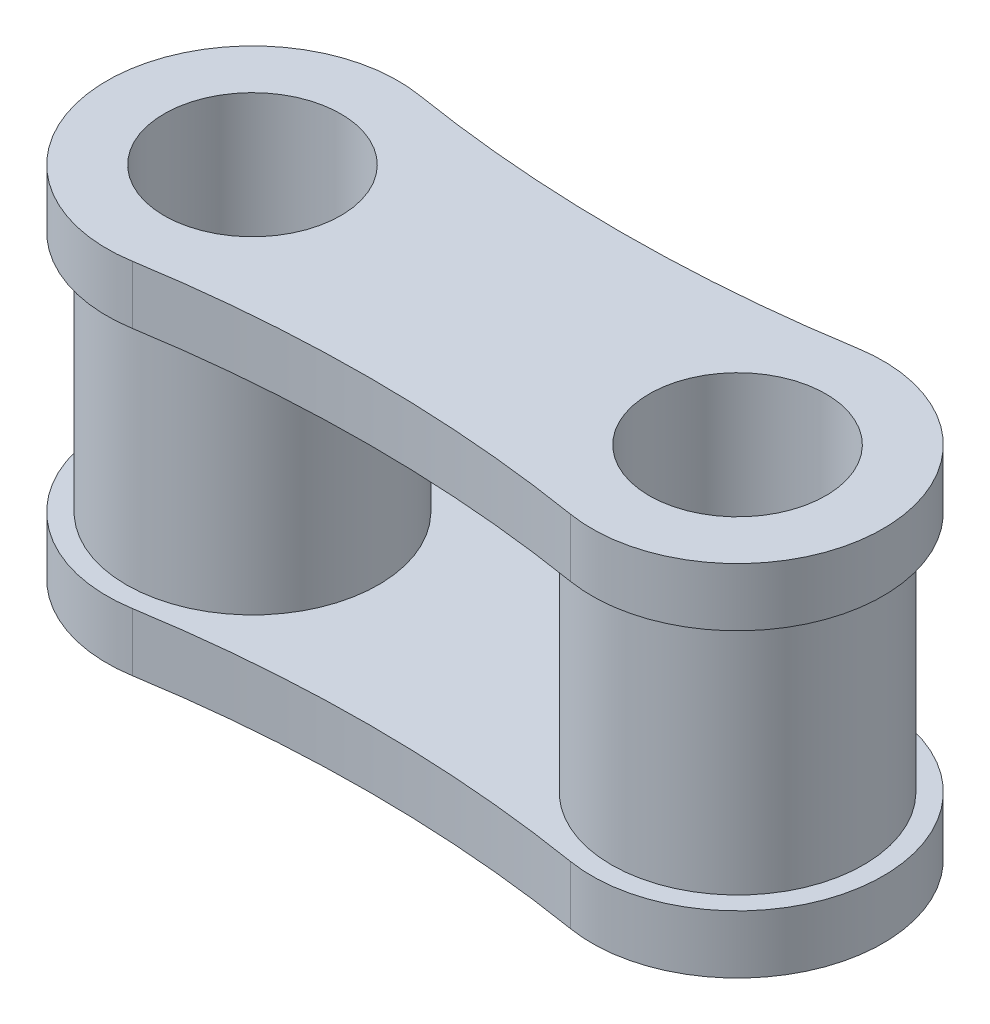
from build123d import *

# Parameters (mm, degrees)
BOSS_EXTRUDE1_DEPTH     = 0.762
SKETCH3_R               = 1.651
SKETCH3_R_2             = 1.1557
BOSS_EXTRUDE2_DEPTH     = 3.175
BOSS_EXTRUDE3_DEPTH     = 0.762
CUT_EXTRUDE1_DEPTH      = 7.703386756
CUT_EXTRUDE1_DEPTH_BACK = 7.703386756
SKETCH5_R               = 1.1557


with BuildPart() as part:
    # Sketch2 → Boss-Extrude1 (new body)
    with BuildSketch(Plane(origin=(0, 0, 0), x_dir=(1, 0, 0), z_dir=(0, 1, 0))):
        with BuildLine():
            ThreePointArc((2.867741935, -1.88005784), (5.08, 0), (2.867741935, 1.88005784))
            ThreePointArc((2.867741935, 1.88005784), (0, 1.647264347), (-2.867741935, 1.88005784))
            ThreePointArc((-2.867741935, 1.88005784), (-5.08, 0), (-2.867741935, -1.88005784))
            ThreePointArc((-2.867741935, -1.88005784), (0, -1.647264347), (2.867741935, -1.88005784))
        make_face()
    extrude(amount=BOSS_EXTRUDE1_DEPTH)

    # Sketch3 → Boss-Extrude2 (add)
    # profile 1 of 2: a face of its own
    with BuildSketch(Plane(origin=(0, 0.762, 0), x_dir=(1, 0, 0), z_dir=(0, 1, 0))):
        with Locations(Location((-3.175, 0, 0), (0, 0, 270))):
            Circle(SKETCH3_R)
        with Locations(Location((-3.175, 0, 0), (0, 0, 270))):
            Circle(SKETCH3_R_2, mode=Mode.SUBTRACT)
    # profile 2 of 2: a face of its own
    with BuildSketch(Plane(origin=(0, 0.762, 0), x_dir=(1, 0, 0), z_dir=(0, 1, 0))):
        with Locations(Location((3.175, 0, 0), (0, 0, 270))):
            Circle(SKETCH3_R)
        with Locations(Location((3.175, 0, 0), (0, 0, 270))):
            Circle(SKETCH3_R_2, mode=Mode.SUBTRACT)
    extrude(amount=BOSS_EXTRUDE2_DEPTH)

    # Sketch4 → Boss-Extrude3 (add)
    with BuildSketch(Plane(origin=(0, 3.937, 0), x_dir=(1, 0, 0), z_dir=(0, 1, 0))):
        with BuildLine():
            ThreePointArc((2.867741935, -1.88005784), (0, -1.647264347), (-2.867741935, -1.88005784))
            ThreePointArc((-2.867741935, -1.88005784), (-5.08, 0), (-2.867741935, 1.88005784))
            ThreePointArc((-2.867741935, 1.88005784), (0, 1.647264347), (2.867741935, 1.88005784))
            ThreePointArc((2.867741935, 1.88005784), (5.08, 0), (2.867741935, -1.88005784))
        make_face()
    extrude(amount=BOSS_EXTRUDE3_DEPTH)

    # Sketch5 → Cut-Extrude1 (cut, two sides: drawn at the far end of the back side and taken through both)
    with BuildSketch(Plane(origin=(0, 0.762, 0), x_dir=(1, 0, 0), z_dir=(0, 1, 0)).offset(-CUT_EXTRUDE1_DEPTH_BACK)):
        with Locations(Location((3.175, 0, 0), (0, 0, 270))):
            Circle(SKETCH5_R)
        with Locations(Location((-3.175, 0, 0), (0, 0, 270))):
            Circle(SKETCH5_R)
    extrude(amount=CUT_EXTRUDE1_DEPTH + CUT_EXTRUDE1_DEPTH_BACK, mode=Mode.SUBTRACT)


solid = part.part
